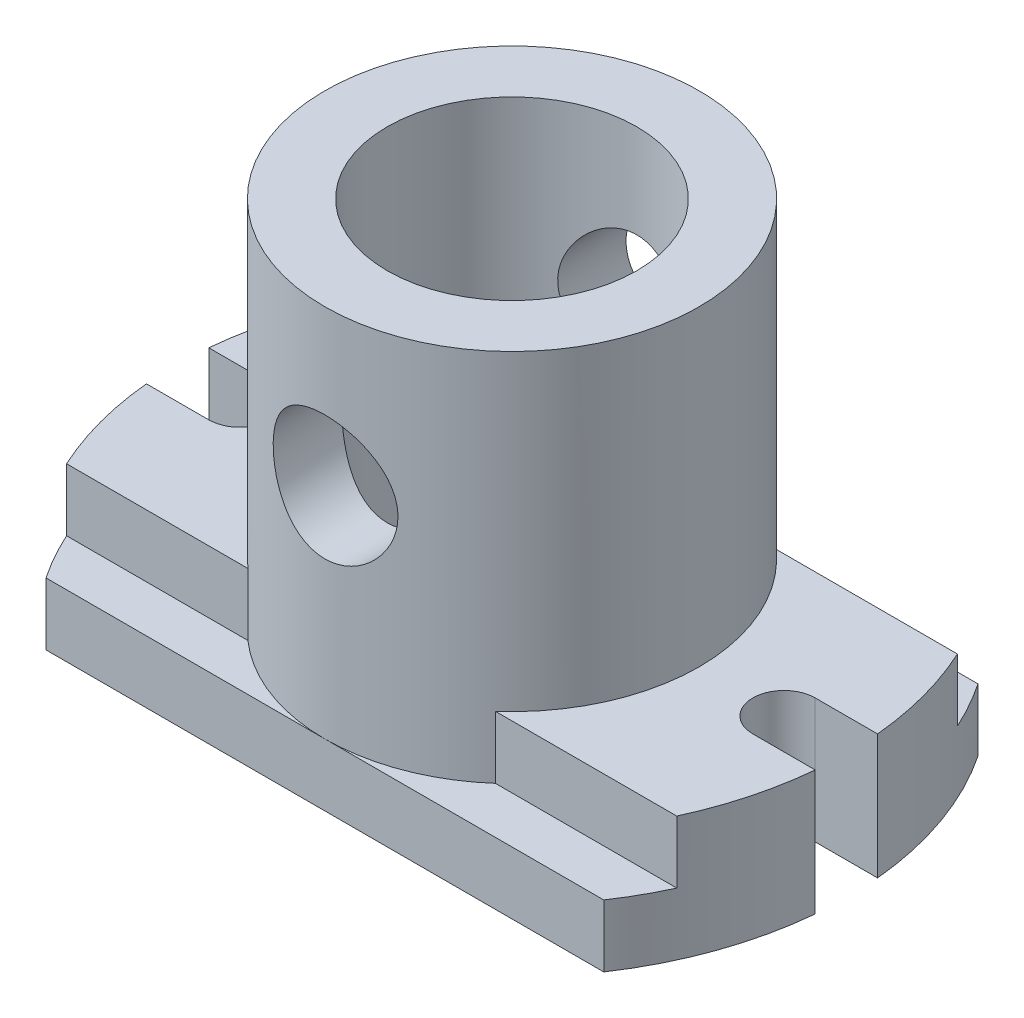
from build123d import *

# Parameters (mm, degrees)
EXTRUDE_1_DEPTH          = 10
SKETCH_3_R               = 30
EXTRUDE_2_DEPTH          = 60
CUT_EXTRUDE_1_DEPTH      = 94.134165345
CUT_EXTRUDE_1_DEPTH_BACK = 94.134165345
SKETCH_4_R               = 10
EXTRUDE_3_DEPTH          = 10
CUT_EXTRUDE_2_DEPTH      = 94.134165377
CUT_EXTRUDE_2_DEPTH_BACK = 94.134165377
SKETCH_8_R               = 20


with BuildPart() as part:
    # 草图2 → 凸台-拉伸1 (new body)
    with BuildSketch(Plane(origin=(0, 0, 0), x_dir=(1, 0, 0), z_dir=(0, 1, 0))):
        with BuildLine():
            Line((53.609446504, 5), (43.609446504, 5))
            ThreePointArc((43.609446504, 5), (38.609446504, 0), (43.609446504, -5))
            Line((43.609446504, -5), (53.609446504, -5))
            ThreePointArc((53.609446504, -5), (50.723980057, -18.056871313), (44.709873121, -30))
            Line((44.709873121, -30), (-44.709873121, -30))
            ThreePointArc((-44.709873121, -30), (-50.723980057, -18.056871313), (-53.609446504, -5))
            Line((-53.609446504, -5), (-43.609446504, -5))
            ThreePointArc((-43.609446504, -5), (-38.609446504, 0), (-43.609446504, 5))
            Line((-43.609446504, 5), (-53.609446504, 5))
            ThreePointArc((-53.609446504, 5), (-50.723980057, 18.056871313), (-44.709873121, 30))
            Line((-44.709873121, 30), (44.709873121, 30))
            ThreePointArc((44.709873121, 30), (50.723980057, 18.056871313), (53.609446504, 5))
        make_face()
    extrude(amount=EXTRUDE_1_DEPTH)

    # 草图3 → 凸台-拉伸2 (add)
    with BuildSketch(Plane(origin=(0, 10, 0), x_dir=(1, 0, 0), z_dir=(0, 1, 0))):
        with Locations(Location((0, 0, 0), (0, 0, 270))):
            Circle(SKETCH_3_R)
    extrude(amount=EXTRUDE_2_DEPTH)

    # 草图4 → 切除-拉伸1 (cut, two sides: drawn at the far end of the back side and taken through both)
    with BuildSketch(Plane.XY.offset(-CUT_EXTRUDE_1_DEPTH_BACK)):
        with Locations(Location((0, 45, 0), (0, 0, 90))):
            Circle(SKETCH_4_R)
    extrude(amount=CUT_EXTRUDE_1_DEPTH + CUT_EXTRUDE_1_DEPTH_BACK, mode=Mode.SUBTRACT)

    # 草图7 → 凸台-拉伸3 (add)
    with BuildSketch(Plane(origin=(0, 10, 0), x_dir=(1, 0, 0), z_dir=(0, 1, 0))):
        with BuildLine():
            Line((-48.915465391, -22.5), (-19.843134833, -22.5))
            ThreePointArc((-19.843134833, -22.5), (-30, 0), (-19.843134833, 22.5))
            Line((-19.843134833, 22.5), (-48.915465391, 22.5))
            ThreePointArc((-48.915465391, 22.5), (-52.003864181, 13.948866071), (-53.609446504, 5))
            Line((-53.609446504, 5), (-43.609446504, 5))
            ThreePointArc((-43.609446504, 5), (-38.609446504, 0), (-43.609446504, -5))
            Line((-43.609446504, -5), (-53.609446504, -5))
            ThreePointArc((-53.609446504, -5), (-52.003864181, -13.948866071), (-48.915465391, -22.5))
        make_face()
        with BuildLine():
            Line((19.843134833, -22.5), (48.915465391, -22.5))
            ThreePointArc((48.915465391, -22.5), (52.003864181, -13.948866071), (53.609446504, -5))
            Line((53.609446504, -5), (43.609446504, -5))
            ThreePointArc((43.609446504, -5), (38.609446504, 0), (43.609446504, 5))
            Line((43.609446504, 5), (53.609446504, 5))
            ThreePointArc((53.609446504, 5), (52.003864181, 13.948866071), (48.915465391, 22.5))
            Line((48.915465391, 22.5), (19.843134833, 22.5))
            ThreePointArc((19.843134833, 22.5), (30, 0), (19.843134833, -22.5))
        make_face()
    extrude(amount=EXTRUDE_3_DEPTH)

    # 草图8 → 切除-拉伸2 (cut, two sides: drawn at the far end of the back side and taken through both)
    with BuildSketch(Plane(origin=(0, 70, 0), x_dir=(1, 0, 0), z_dir=(0, 1, 0)).offset(-CUT_EXTRUDE_2_DEPTH_BACK)):
        with Locations(Location((0, 0, 0), (0, 0, 270))):
            Circle(SKETCH_8_R)
    extrude(amount=CUT_EXTRUDE_2_DEPTH + CUT_EXTRUDE_2_DEPTH_BACK, mode=Mode.SUBTRACT)


solid = part.part
